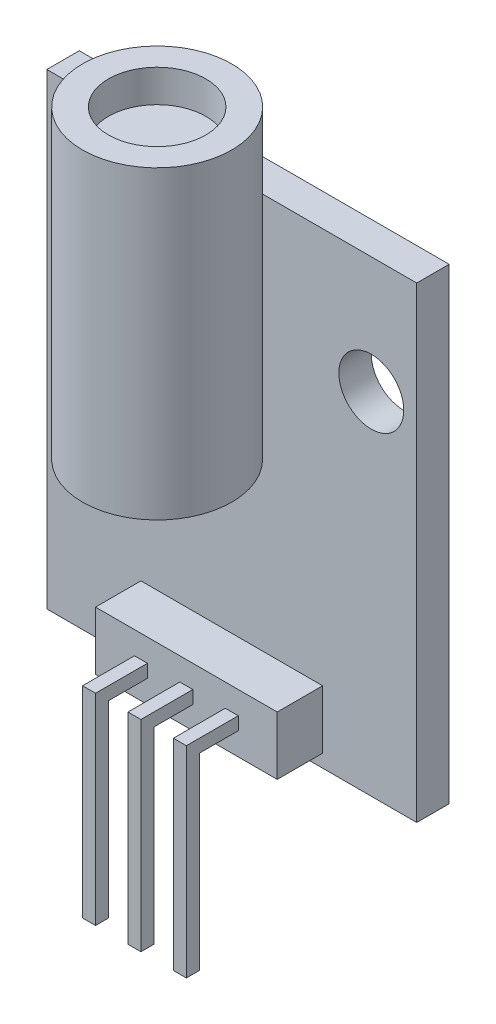
from build123d import *

# Parameters (mm, degrees)
SKETCH1_W                = 14.478
SKETCH1_H                = 18.288
BOSS_EXTRUDE1_DEPTH      = 0.635
SKETCH2_W                = 7.112
SKETCH2_H                = 2.286
BOSS_EXTRUDE2_DEPTH      = 1.778
SKETCH3_W                = 0.508
SKETCH3_H                = 0.508
BOSS_EXTRUDE3_DEPTH      = 2.032
SKETCH4_W                = 0.508
SKETCH4_H                = 0.508
BOSS_EXTRUDE4_DEPTH      = 7.366
CUT_EXTRUDE1_DEPTH       = 18.184934972
CUT_EXTRUDE1_DEPTH_BACK  = 18.184934972
SKETCH5_R                = 1.27
BOSS_EXTRUDE5_DEPTH      = 3.81
BOSS_EXTRUDE5_DEPTH_BACK = 8.128
SKETCH6_R                = 2.921
SKETCH7_R                = 1.905
CUT_EXTRUDE2_DEPTH       = 1.27


with BuildPart() as part:
    # Sketch1 → Boss-Extrude1 (new, symmetric)
    with BuildSketch(Plane.XY):
        Rectangle(SKETCH1_W, SKETCH1_H)
    extrude(amount=BOSS_EXTRUDE1_DEPTH, both=True)

    # Sketch2 → Boss-Extrude2 (add)
    with BuildSketch(Plane.XY.offset(0.635)):
        with Locations((0, -7.493)):
            Rectangle(SKETCH2_W, SKETCH2_H)
    extrude(amount=BOSS_EXTRUDE2_DEPTH)

    # Sketch3 → Boss-Extrude3 (add)
    with BuildSketch(Plane.XY.offset(2.413)):
        with Locations((-1.778, -7.493)):
            Rectangle(SKETCH3_W, SKETCH3_H)
        with Locations((0, -7.493)):
            Rectangle(SKETCH3_W, SKETCH3_H)
        with Locations((1.778, -7.493)):
            Rectangle(SKETCH3_W, SKETCH3_H)
    extrude(amount=BOSS_EXTRUDE3_DEPTH)

    # Sketch4 → Boss-Extrude4 (add)
    with BuildSketch(Plane.XZ.offset(7.747)):
        with Locations((-1.778, 4.191)):
            Rectangle(SKETCH4_W, SKETCH4_H)
        with Locations((0, 4.191)):
            Rectangle(SKETCH4_W, SKETCH4_H)
        with Locations((1.778, 4.191)):
            Rectangle(SKETCH4_W, SKETCH4_H)
    extrude(amount=BOSS_EXTRUDE4_DEPTH)

    # Sketch5 → Cut-Extrude1 (cut, two sides: drawn at the far end of the back side and taken through both)
    with BuildSketch(Plane.XY.offset(0.635).offset(-CUT_EXTRUDE1_DEPTH_BACK)):
        with Locations((-5.461, 4.572)):
            Circle(SKETCH5_R)
        with Locations((5.461, 4.572)):
            Circle(SKETCH5_R)
    extrude(amount=CUT_EXTRUDE1_DEPTH + CUT_EXTRUDE1_DEPTH_BACK, mode=Mode.SUBTRACT)


with BuildPart() as body_2:
    # Sketch6 → Boss-Extrude5 (new, two sides: drawn at the far end of the back side and taken through both)
    with BuildSketch(Plane(origin=(0, 9.144, 0), x_dir=(1, 0, 0), z_dir=(0, 1, 0)).offset(-BOSS_EXTRUDE5_DEPTH_BACK)):
        with Locations(Location((0, -3.556, 0), (0, 0, 270))):
            Circle(SKETCH6_R)
    extrude(amount=BOSS_EXTRUDE5_DEPTH + BOSS_EXTRUDE5_DEPTH_BACK)

    # Sketch7 → Cut-Extrude2 (cut)
    with BuildSketch(Plane(origin=(0, 12.954, 0), x_dir=(1, 0, 0), z_dir=(0, 1, 0))):
        with Locations(Location((0, -3.556, 0), (0, 0, 270))):
            Circle(SKETCH7_R)
    extrude(amount=-CUT_EXTRUDE2_DEPTH, mode=Mode.SUBTRACT)


solid = Compound([part.part, body_2.part])
